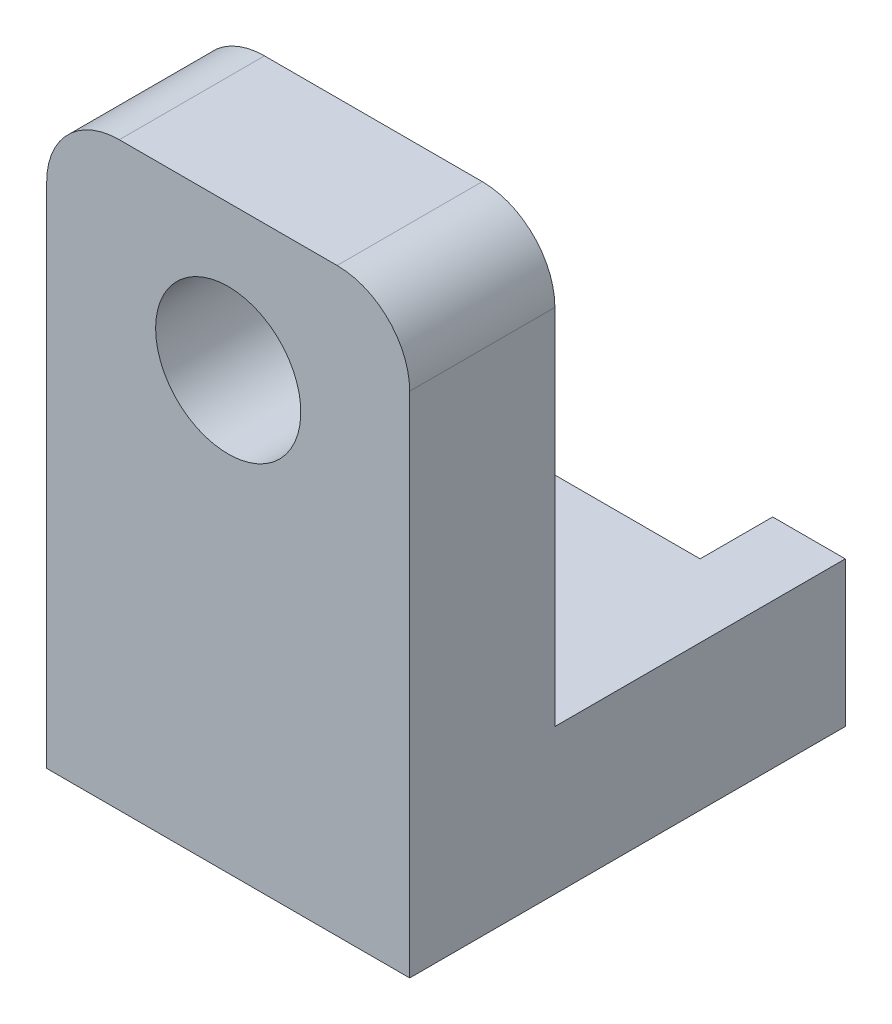
from build123d import *

# Parameters (mm, degrees)
ESTRUSIONE_ESTRUSIONE1_DEPTH  = 12.5
TAGLIO_ESTRUSIONE1_DEPTH      = 45.229515032
TAGLIO_ESTRUSIONE1_DEPTH_BACK = 45.229515032
SCHIZZO2_W                    = 15
SCHIZZO2_H                    = 5
FORO_10_0_10_1_D              = 10
RACCORDO1_R                   = 5


with BuildPart() as part:
    # Schizzo1 → Estrusione-Estrusione1 (new, symmetric)
    with BuildSketch(Plane(origin=(0, 0, 0), x_dir=(0, 0, -1), z_dir=(1, 0, 0))):
        Polygon((0, 0), (0, 40), (10, 40), (10, 10), (30, 10), (30, 0), align=None)
    extrude(amount=ESTRUSIONE_ESTRUSIONE1_DEPTH, both=True)

    # Schizzo2 → Taglio-Estrusione1 (cut, two sides: drawn at the far end of the back side and taken through both)
    with BuildSketch(Plane(origin=(0, 10, 0), x_dir=(1, 0, 0), z_dir=(0, 1, 0)).offset(-TAGLIO_ESTRUSIONE1_DEPTH_BACK)):
        with Locations((0, 27.5)):
            Rectangle(SCHIZZO2_W, SCHIZZO2_H)
    extrude(amount=TAGLIO_ESTRUSIONE1_DEPTH + TAGLIO_ESTRUSIONE1_DEPTH_BACK, mode=Mode.SUBTRACT)

    # Foro Ø10.0 (10)-1 (through all)
    with Locations(Plane(origin=(0, 0, -10), x_dir=(-1, 0, 0), z_dir=(0, 0, -1))):
        with Locations((0, 30)):
            Hole(FORO_10_0_10_1_D / 2)

    # Raccordo1
    raccordo1_edges = [part.edges().sort_by_distance(p)[0] for p in [
        (12.5, 40, -5),
        (-12.5, 40, -5),
    ]]
    fillet(raccordo1_edges, radius=RACCORDO1_R)


solid = part.part
